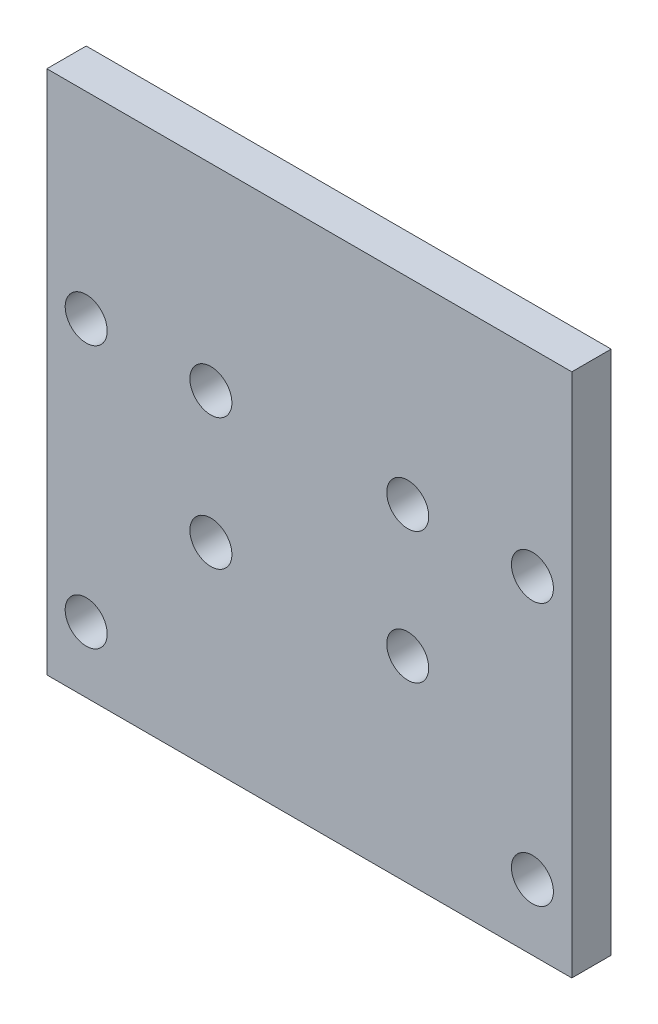
from build123d import *

# Parameters (mm, degrees)
SKETCH_1_W          = 40
SKETCH_1_H          = 40
EXTRUDE_1_DEPTH     = 3
SKETCH_2_R          = 1.6
CUT_EXTRUDE_1_DEPTH = 29.442925307


with BuildPart() as part:
    # 草图1 → 凸台-拉伸1 (new body)
    with BuildSketch(Plane.XY):
        Rectangle(SKETCH_1_W, SKETCH_1_H)
    extrude(amount=EXTRUDE_1_DEPTH)

    # 草图2 → 切除-拉伸1 (cut, through all)
    with BuildSketch(Plane.XY.offset(3)):
        with Locations((-7.5, 5)):
            Circle(SKETCH_2_R)
        with Locations((7.5, 5)):
            Circle(SKETCH_2_R)
        with Locations((7.5, -5)):
            Circle(SKETCH_2_R)
        with Locations((-7.5, -5)):
            Circle(SKETCH_2_R)
        with Locations((-17, -15)):
            Circle(SKETCH_2_R)
        with Locations((-17, 5)):
            Circle(SKETCH_2_R)
        with Locations(Location((17, 5, 0), (0, 0, 180))):
            Circle(SKETCH_2_R)
        with Locations(Location((17, -15, 0), (0, 0, 180))):
            Circle(SKETCH_2_R)
    extrude(amount=-CUT_EXTRUDE_1_DEPTH, mode=Mode.SUBTRACT)


solid = part.part
